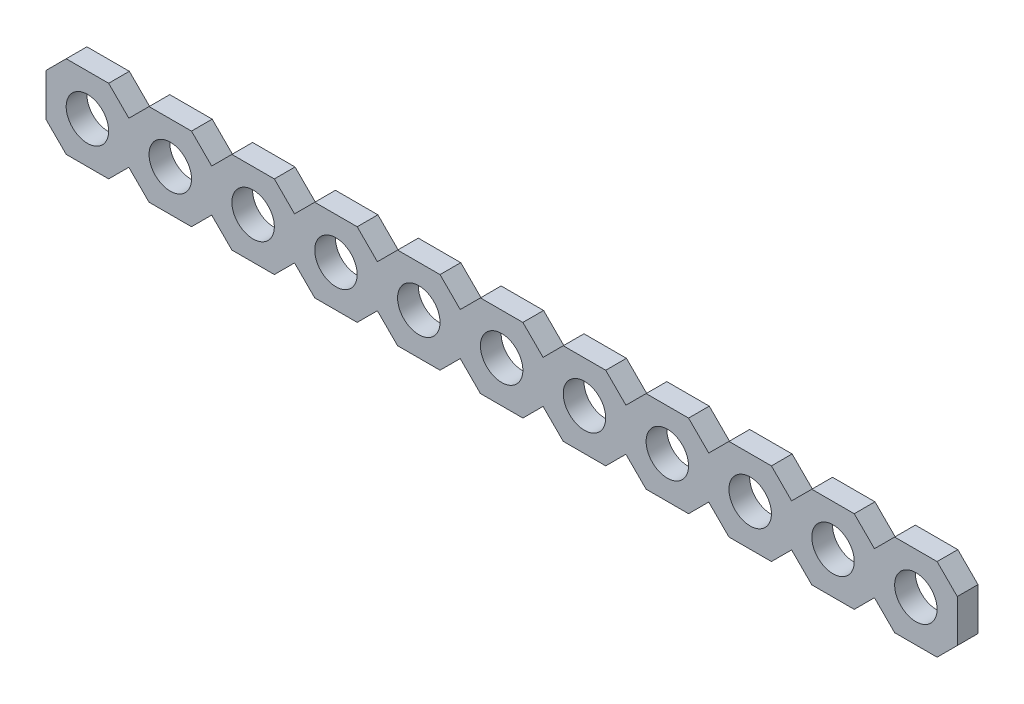
from build123d import *

# Parameters (mm, degrees)
SKETCH2_R           = 2.05
BOSS_EXTRUDE1_DEPTH = 2
LPATTERN1_COUNT     = 11
LPATTERN1_PITCH     = 8


with BuildPart() as part:
    # Sketch2 → Boss-Extrude1 (new body)
    with BuildSketch(Plane.XY):
        Polygon((-2.05, -4), (-4, -2.05), (-4, 2.05), (-2.05, 4), (2.05, 4), (4, 2.05), (4, -2.05), (2.05, -4), align=None)
        Circle(SKETCH2_R, mode=Mode.SUBTRACT)
    boss_extrude1 = extrude(amount=BOSS_EXTRUDE1_DEPTH)

    # LPattern1: Boss-Extrude1 ×11
    with Locations(*[(i * LPATTERN1_PITCH, 0, 0) for i in range(1, LPATTERN1_COUNT)]):
        add(boss_extrude1)


solid = part.part
